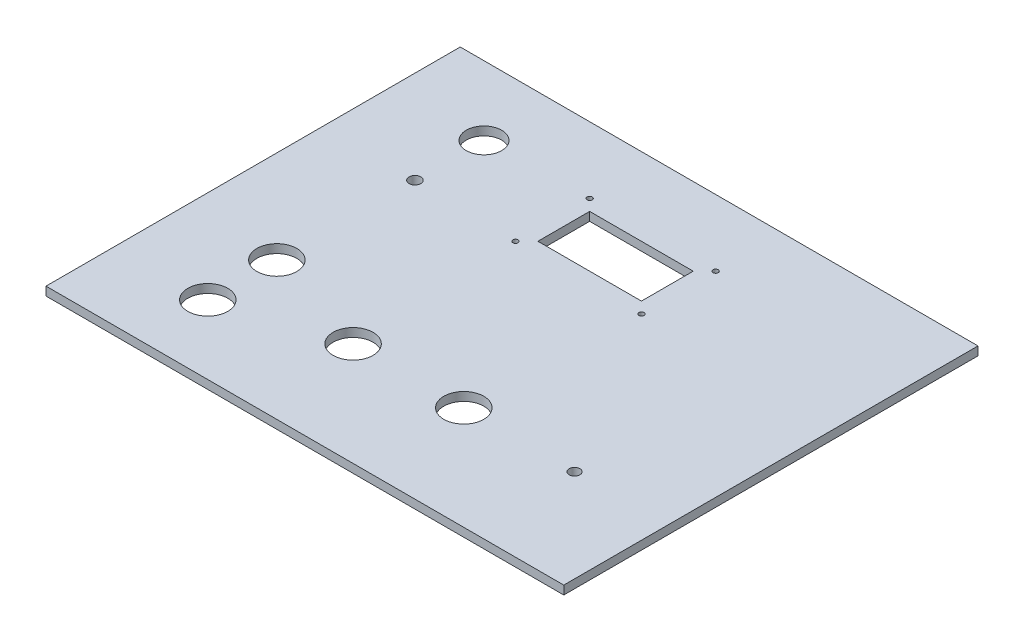
from build123d import *

# Parameters (mm, degrees)
SKETCH1_W           = 300
SKETCH1_H           = 240
BOSS_EXTRUDE1_DEPTH = 5
SKETCH2_R           = 10.25
SKETCH2_R_2         = 11.58
SKETCH2_R_3         = 3.4
SKETCH2_R_4         = 3.1
SKETCH2_R_5         = 1.5
SKETCH2_W           = 60
SKETCH2_H           = 30
CUT_EXTRUDE4_DEPTH  = 193.158788506


with BuildPart() as part:
    # Sketch1 → Boss-Extrude1 (new body)
    with BuildSketch(Plane(origin=(0, 0, 0), x_dir=(1, 0, 0), z_dir=(0, 1, 0))):
        Rectangle(SKETCH1_W, SKETCH1_H)
    extrude(amount=BOSS_EXTRUDE1_DEPTH)

    # Sketch2 → Cut-Extrude4 (cut, through all)
    with BuildSketch(Plane(origin=(0, 0, 0), x_dir=(1, 0, 0), z_dir=(0, 1, 0))):
        with Locations(Location((-96.25, 80, 0), (0, 0, 270))):
            Circle(SKETCH2_R)
        with Locations(Location((-96.25, -40, 0), (0, 0, 270))):
            Circle(SKETCH2_R_2)
        with Locations(Location((-96.25, -80, 0), (0, 0, 270))):
            Circle(SKETCH2_R_2)
        with Locations(Location((-96.25, 40, 0), (0, 0, 270))):
            Circle(SKETCH2_R_3)
        with Locations(Location((-32.08, -60, 0), (0, 0, 270))):
            Circle(SKETCH2_R_2)
        with Locations(Location((32.08, -60, 0), (0, 0, 270))):
            Circle(SKETCH2_R_2)
        with Locations(Location((96.25, -60, 0), (0, 0, 270))):
            Circle(SKETCH2_R_4)
        with Locations(Location((36.5, 38.5, 0), (0, 0, 270))):
            Circle(SKETCH2_R_5)
        with Locations(Location((36.5, 81.5, 0), (0, 0, 270))):
            Circle(SKETCH2_R_5)
        with Locations(Location((-36.5, 81.5, 0), (0, 0, 270))):
            Circle(SKETCH2_R_5)
        with Locations(Location((-36.5, 38.5, 0), (0, 0, 270))):
            Circle(SKETCH2_R_5)
        with Locations((0, 60)):
            Rectangle(SKETCH2_W, SKETCH2_H)
    extrude(amount=CUT_EXTRUDE4_DEPTH, mode=Mode.SUBTRACT)


solid = part.part
